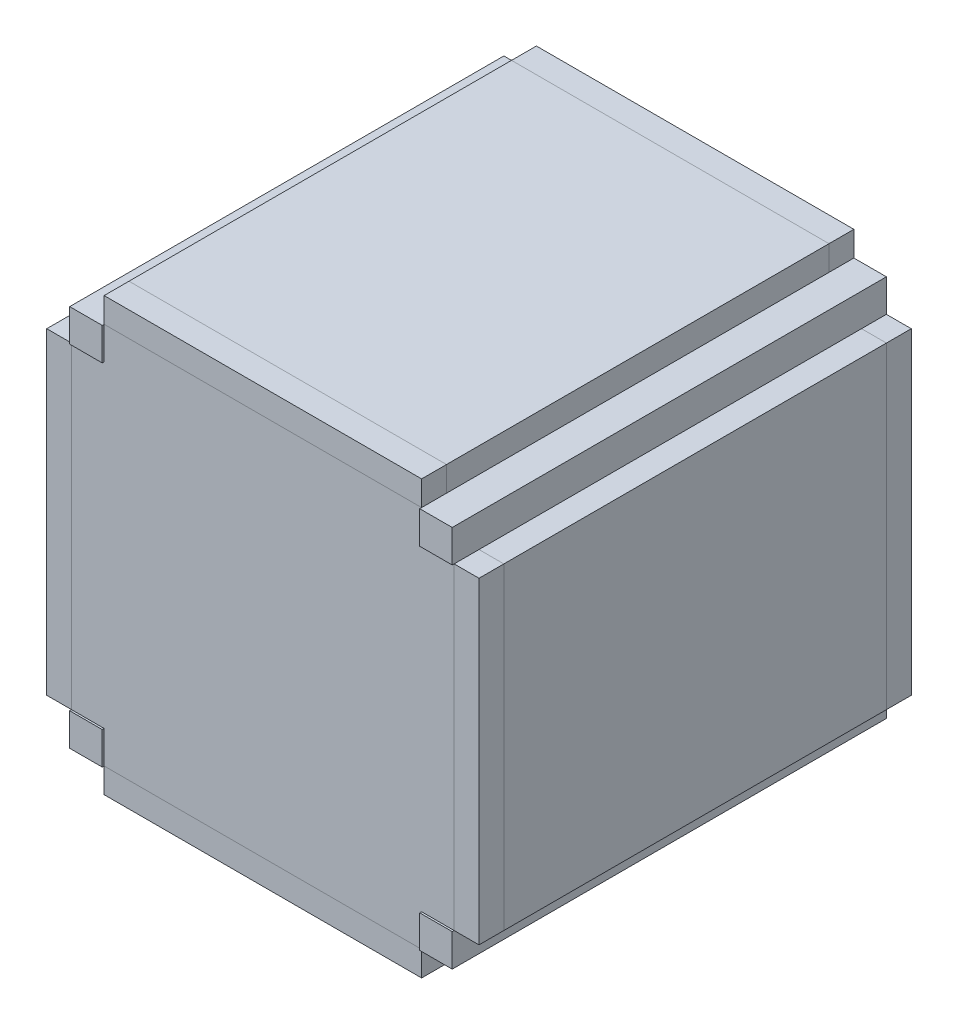
from build123d import *

# Parameters (mm, degrees)
BOSS_EXTRUDE1_DEPTH      = 56.75
BOSS_EXTRUDE1_DEPTH_BACK = 56.75
SKETCH1_W                = 100
SKETCH1_H                = 100
SKETCH3_W                = 83
SKETCH3_H                = 83
SKETCH3_H_2              = 8.5
SKETCH3_W_2              = 8.5
CUT_EXTRUDE1_DEPTH       = 7
CUT_EXTRUDE2_DEPTH       = 6.5
SKETCH5_W                = 100
SKETCH5_H                = 83
BOSS_EXTRUDE2_DEPTH      = 6.5
SKETCH6_W                = 83
SKETCH6_H                = 100
BOSS_EXTRUDE3_DEPTH      = 6.5
SKETCH7_W                = 100
SKETCH7_H                = 83
BOSS_EXTRUDE4_DEPTH      = 6.5
BOSS_EXTRUDE5_DEPTH      = 6.5
BOSS_EXTRUDE6_DEPTH      = 6.5
SKETCH11_W               = 83
SKETCH11_H               = 100
BOSS_EXTRUDE7_DEPTH      = 6.5
SKETCH15_W               = 6.5
SKETCH15_H               = 6.5
BOSS_EXTRUDE10_DEPTH     = 83
BOSS_EXTRUDE10_2_DEPTH   = 83
BOSS_EXTRUDE10_3_DEPTH   = 83
BOSS_EXTRUDE10_4_DEPTH   = 83
SKETCH16_W               = 6.5
SKETCH16_H               = 6.5
BOSS_EXTRUDE11_DEPTH     = 83
BOSS_EXTRUDE11_2_DEPTH   = 83
BOSS_EXTRUDE11_3_DEPTH   = 83
BOSS_EXTRUDE11_4_DEPTH   = 83


with BuildPart() as part:
    # Sketch1 → Boss-Extrude1 (new, two sides: drawn at the far end of the back side and taken through both)
    with BuildSketch(Plane.XY.offset(-BOSS_EXTRUDE1_DEPTH_BACK)):
        Rectangle(SKETCH1_W, SKETCH1_H)
    extrude(amount=BOSS_EXTRUDE1_DEPTH + BOSS_EXTRUDE1_DEPTH_BACK)

    # Sketch3 → Cut-Extrude1 (cut)
    with BuildSketch(Plane.XY.offset(56.75)):
        Rectangle(SKETCH3_W, SKETCH3_H)
        with Locations((0, 45.75)):
            Rectangle(SKETCH3_W, SKETCH3_H_2)
        with Locations((-45.75, 0)):
            Rectangle(SKETCH3_W_2, SKETCH3_H)
        with Locations((0, -45.75)):
            Rectangle(SKETCH3_W, SKETCH3_H_2)
        with Locations((45.75, 0)):
            Rectangle(SKETCH3_W_2, SKETCH3_H)
    extrude(amount=-CUT_EXTRUDE1_DEPTH, mode=Mode.SUBTRACT)

    # Sketch4 → Cut-Extrude2 (cut)
    with BuildSketch(Plane(origin=(0, 0, -56.75), x_dir=(-1, 0, 0), z_dir=(0, 0, -1))):
        Polygon((-41.5, -41.5), (-41.5, -50), (41.5, -50), (41.5, -41.5), (50, -41.5), (50, 41.5), (41.5, 41.5), (41.5, 50), (-41.5, 50), (-41.5, 41.5), (-50, 41.5), (-50, -41.5), align=None)
    extrude(amount=-CUT_EXTRUDE2_DEPTH, mode=Mode.SUBTRACT)


with BuildPart() as body_2:
    # Sketch5 → Boss-Extrude2 (new body)
    with BuildSketch(Plane.ZY.offset(50)):
        with Locations((-0.25, 0)):
            Rectangle(SKETCH5_W, SKETCH5_H)
    extrude(amount=BOSS_EXTRUDE2_DEPTH)


with BuildPart() as body_3:
    # Sketch6 → Boss-Extrude3 (new body)
    with BuildSketch(Plane(origin=(0, 50, 0), x_dir=(1, 0, 0), z_dir=(0, 1, 0))):
        with Locations((0, 0.25)):
            Rectangle(SKETCH6_W, SKETCH6_H)
    extrude(amount=BOSS_EXTRUDE3_DEPTH)


with BuildPart() as body_4:
    # Sketch7 → Boss-Extrude4 (new body)
    with BuildSketch(Plane(origin=(50, 0, 0), x_dir=(0, 0, -1), z_dir=(1, 0, 0))):
        with Locations((0.25, 0)):
            Rectangle(SKETCH7_W, SKETCH7_H)
    extrude(amount=BOSS_EXTRUDE4_DEPTH)


with BuildPart() as body_5:
    # Sketch9 → Boss-Extrude5 (new body)
    with BuildSketch(Plane.XY.offset(49.75)):
        Polygon((41.5, -50), (41.5, -41.5), (50, -41.5), (50, 41.5), (41.5, 41.5), (41.5, 50), (-41.5, 50), (-41.5, 41.5), (-50, 41.5), (-50, -41.5), (-41.5, -41.5), (-41.5, -50), align=None)
    extrude(amount=BOSS_EXTRUDE5_DEPTH)


with BuildPart() as body_6:
    # Sketch10 → Boss-Extrude6 (new body)
    with BuildSketch(Plane(origin=(0, 0, -50.25), x_dir=(-1, 0, 0), z_dir=(0, 0, -1))):
        Polygon((-41.5, -50), (41.5, -50), (41.5, -41.5), (50, -41.5), (50, 41.5), (41.5, 41.5), (41.5, 50), (-41.5, 50), (-41.5, 41.5), (-50, 41.5), (-50, -41.5), (-41.5, -41.5), align=None)
    extrude(amount=BOSS_EXTRUDE6_DEPTH)


with BuildPart() as body_7:
    # Sketch11 → Boss-Extrude7 (new body)
    with BuildSketch(Plane.XZ.offset(50)):
        with Locations((0, -0.25)):
            Rectangle(SKETCH11_W, SKETCH11_H)
    extrude(amount=BOSS_EXTRUDE7_DEPTH)


with BuildPart() as body_8:
    # Sketch15 → Boss-Extrude10 (new body)
    with BuildSketch(Plane(origin=(41.5, 0, 0), x_dir=(0, 0, -1), z_dir=(1, 0, 0))):
        with Locations((53.5, 53.25)):
            Rectangle(SKETCH15_W, SKETCH15_H)
    extrude(amount=-BOSS_EXTRUDE10_DEPTH)


with BuildPart() as body_9:
    # Sketch15 → Boss-Extrude10 2 (new body)
    with BuildSketch(Plane(origin=(41.5, 0, 0), x_dir=(0, 0, -1), z_dir=(1, 0, 0))):
        with Locations((53.5, -53.25)):
            Rectangle(SKETCH15_W, SKETCH15_H)
    extrude(amount=-BOSS_EXTRUDE10_2_DEPTH)


with BuildPart() as body_10:
    # Sketch15 → Boss-Extrude10 3 (new body)
    with BuildSketch(Plane(origin=(41.5, 0, 0), x_dir=(0, 0, -1), z_dir=(1, 0, 0))):
        with Locations((-53, -53.25)):
            Rectangle(SKETCH15_W, SKETCH15_H)
    extrude(amount=-BOSS_EXTRUDE10_3_DEPTH)


with BuildPart() as body_11:
    # Sketch15 → Boss-Extrude10 4 (new body)
    with BuildSketch(Plane(origin=(41.5, 0, 0), x_dir=(0, 0, -1), z_dir=(1, 0, 0))):
        with Locations((-53, 53.25)):
            Rectangle(SKETCH15_W, SKETCH15_H)
    extrude(amount=-BOSS_EXTRUDE10_4_DEPTH)


with BuildPart() as body_12:
    # Sketch16 → Boss-Extrude11 (new body)
    with BuildSketch(Plane(origin=(0, 41.5, 0), x_dir=(1, 0, 0), z_dir=(0, 1, 0))):
        with Locations((53.25, 53.5)):
            Rectangle(SKETCH16_W, SKETCH16_H)
    extrude(amount=-BOSS_EXTRUDE11_DEPTH)


with BuildPart() as body_13:
    # Sketch16 → Boss-Extrude11 2 (new body)
    with BuildSketch(Plane(origin=(0, 41.5, 0), x_dir=(1, 0, 0), z_dir=(0, 1, 0))):
        with Locations((-53.25, 53.5)):
            Rectangle(SKETCH16_W, SKETCH16_H)
    extrude(amount=-BOSS_EXTRUDE11_2_DEPTH)


with BuildPart() as body_14:
    # Sketch16 → Boss-Extrude11 3 (new body)
    with BuildSketch(Plane(origin=(0, 41.5, 0), x_dir=(1, 0, 0), z_dir=(0, 1, 0))):
        with Locations((-53.25, -53)):
            Rectangle(SKETCH16_W, SKETCH16_H)
    extrude(amount=-BOSS_EXTRUDE11_3_DEPTH)


with BuildPart() as body_15:
    # Sketch16 → Boss-Extrude11 4 (new body)
    with BuildSketch(Plane(origin=(0, 41.5, 0), x_dir=(1, 0, 0), z_dir=(0, 1, 0))):
        with Locations((53.25, -53)):
            Rectangle(SKETCH16_W, SKETCH16_H)
    extrude(amount=-BOSS_EXTRUDE11_4_DEPTH)


solid = Compound([part.part, body_2.part, body_3.part, body_4.part, body_5.part, body_6.part, body_7.part, body_8.part, body_9.part, body_10.part, body_11.part, body_12.part, body_13.part, body_14.part, body_15.part])
